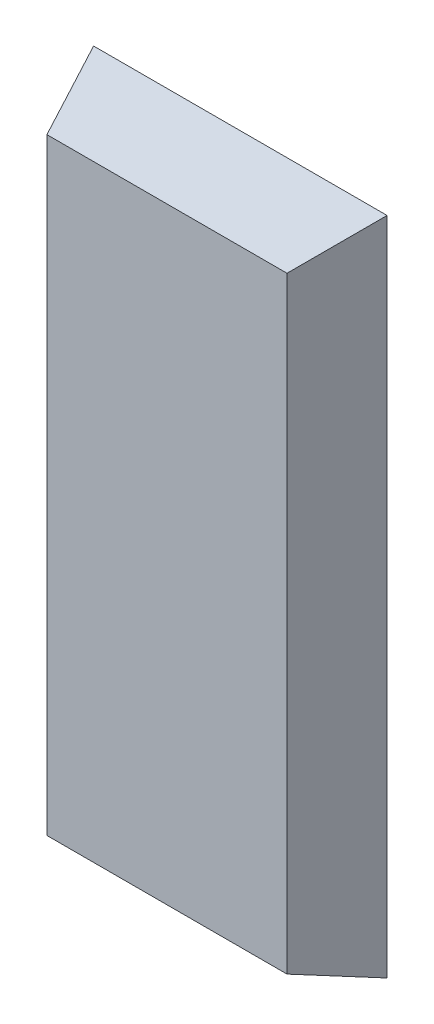
from build123d import *

# Parameters (mm, degrees)
SKETCH1_W           = 20
SKETCH1_H           = 45
BOSS_EXTRUDE1_DEPTH = 5
BOSS_EXTRUDE1_TAPER = 20


with BuildPart() as part:
    # Sketch1 → Boss-Extrude1 (new body)
    with BuildSketch(Plane.XY):
        Rectangle(SKETCH1_W, SKETCH1_H)
    extrude(amount=BOSS_EXTRUDE1_DEPTH, taper=BOSS_EXTRUDE1_TAPER)


solid = part.part
